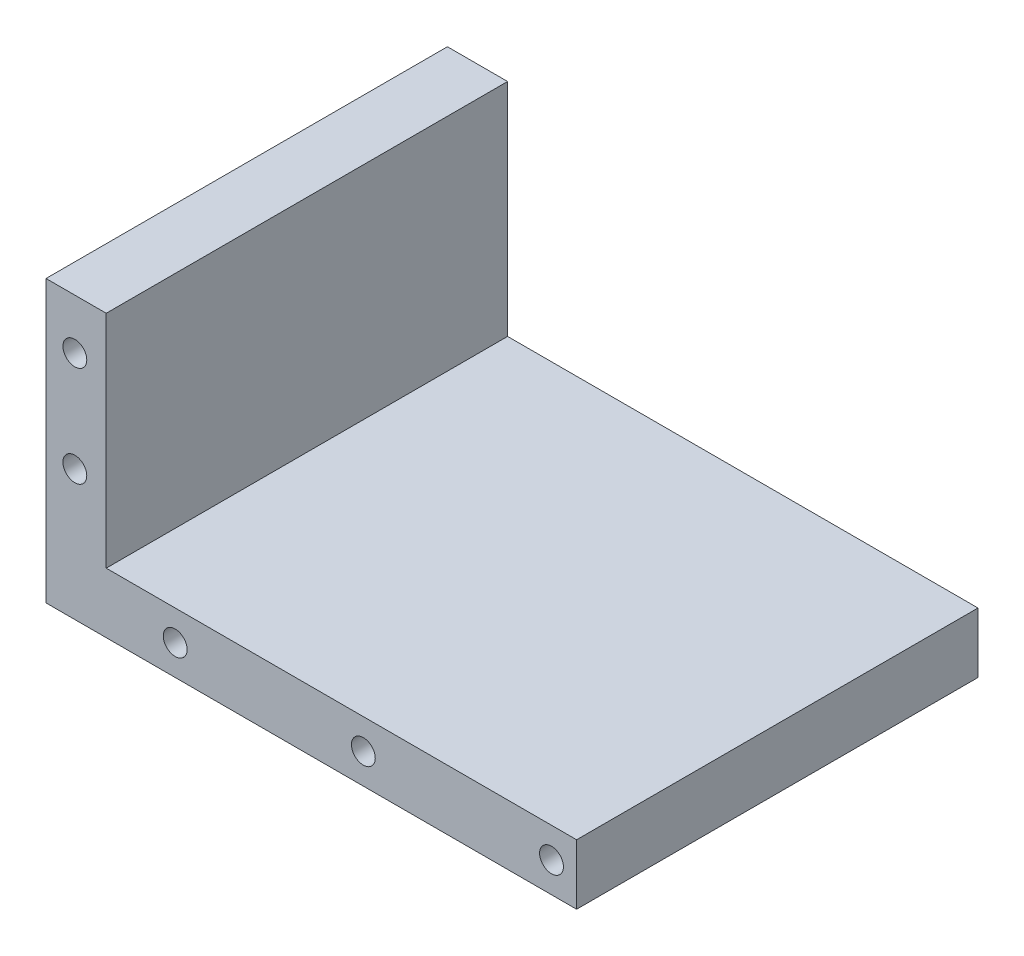
from build123d import *

# Parameters (mm, degrees)
SKETCH_1_R      = 0.95
EXTRUDE_1_DEPTH = 32


with BuildPart() as part:
    # 草图1 → 凸台-拉伸1 (new body)
    with BuildSketch(Plane.XY):
        Polygon((0, 17.6), (0, 0), (37.5, 0), (37.5, -4.8), (-4.8, -4.8), (-4.8, 17.6), align=None)
        with Locations((-2.5, 13.6)):
            Circle(SKETCH_1_R, mode=Mode.SUBTRACT)
        with Locations((35.5, -2.4)):
            Circle(SKETCH_1_R, mode=Mode.SUBTRACT)
        with Locations((20.5, -2.4)):
            Circle(SKETCH_1_R, mode=Mode.SUBTRACT)
        with Locations((5.5, -2.4)):
            Circle(SKETCH_1_R, mode=Mode.SUBTRACT)
        with Locations((-2.5, 5.6)):
            Circle(SKETCH_1_R, mode=Mode.SUBTRACT)
    extrude(amount=EXTRUDE_1_DEPTH)


solid = part.part
